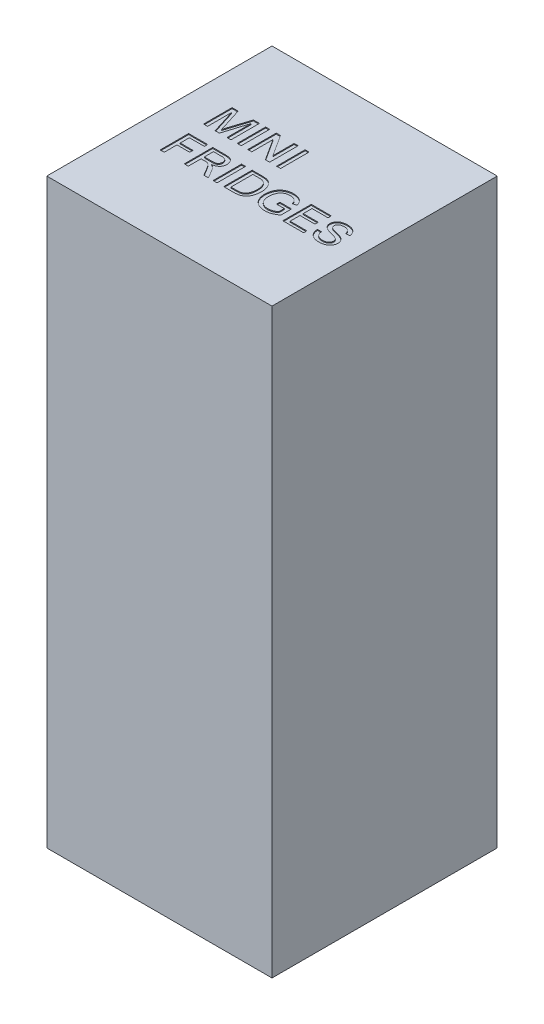
from build123d import *

# Parameters (mm, degrees)
SKETCH1_W           = 609.6
SKETCH1_H           = 609.6
BOSS_EXTRUDE1_DEPTH = 1574.8
SKETCH2_W           = 10.865963666
SKETCH2_H           = 77.049560547
SKETCH2_W_2         = 10.865963667
CUT_EXTRUDE1_DEPTH  = 2.54


with BuildPart() as part:
    # Sketch1 → Boss-Extrude1 (new body)
    with BuildSketch(Plane(origin=(0, 0, 0), x_dir=(1, 0, 0), z_dir=(0, 1, 0))):
        Rectangle(SKETCH1_W, SKETCH1_H)
    extrude(amount=BOSS_EXTRUDE1_DEPTH)

    # Sketch2 → Cut-Extrude1 (cut)
    # profile 1 of 11: a face of its own
    with BuildSketch(Plane(origin=(0, 1574.8, 0), x_dir=(1, 0, 0), z_dir=(0, 1, 0))):
        with BuildLine():
            Line((-214.489253179, 29.371225042), (-214.489253179, 106.420785589))
            Line((-214.489253179, 106.420785589), (-198.144003856, 106.420785589))
            Line((-198.144003856, 106.420785589), (-180.918981907, 52.353355582))
            add(Edge.make_bspline(
                [(-180.918981907, 52.353355582), (-180.729419808, 51.740865825), (-180.362817744, 50.55634629), (-179.819190376, 48.845791087), (-179.324580609, 47.256213448), (-178.879106629, 45.782553663), (-178.458707079, 44.432128387), (-178.09470731, 43.193856382), (-177.746711688, 42.081497605), (-177.542770703, 41.374557231), (-177.446195223, 41.039788298)],
                knots=[0, 0, 0, 0, 1.300204174, 2.514519184, 3.639827924, 4.676153899, 5.636536826, 6.507959918, 7.293450077, 8, 8, 8, 8], degree=3))
            add(Edge.make_bspline(
                [(-177.446195223, 41.039788298), (-177.338632565, 41.405217862), (-177.109732348, 42.182875343), (-176.738648507, 43.405608427), (-176.343804734, 44.758700172), (-175.871297766, 46.21889314), (-175.378765174, 47.809093173), (-174.861788117, 49.527979662), (-174.265465149, 51.358391588), (-173.869178735, 52.625613897), (-173.66471639, 53.279432031)],
                knots=[0, 0, 0, 0, 0.713638162, 1.518667645, 2.393860736, 3.354087503, 4.393659122, 5.512594909, 6.716633584, 8, 8, 8, 8], degree=3))
            Line((-173.66471639, 53.279432031), (-156.609475124, 106.420785589))
            Line((-156.609475124, 106.420785589), (-140.403137268, 106.420785589))
            Line((-140.403137268, 106.420785589), (-140.403137268, 29.371225042))
            Line((-140.403137268, 29.371225042), (-151.269100935, 29.371225042))
            Line((-151.269100935, 29.371225042), (-151.269100935, 94.567007043))
            Line((-151.269100935, 94.567007043), (-171.8279981, 29.371225042))
            Line((-171.8279981, 29.371225042), (-183.187869206, 29.371225042))
            Line((-183.187869206, 29.371225042), (-203.623289512, 94.567007043))
            Line((-203.623289512, 94.567007043), (-203.623289512, 29.371225042))
            Line((-203.623289512, 29.371225042), (-214.489253179, 29.371225042))
        make_face()
    # profile 2 of 11: a face of its own
    with BuildSketch(Plane(origin=(0, 1574.8, 0), x_dir=(1, 0, 0), z_dir=(0, 1, 0))):
        with Locations((-118.177302495, 67.896005316)):
            Rectangle(SKETCH2_W, SKETCH2_H)
    # profile 3 of 11: a face of its own
    with BuildSketch(Plane(origin=(0, 1574.8, 0), x_dir=(1, 0, 0), z_dir=(0, 1, 0))):
        Polygon((-94.963652843, 29.371225042), (-94.963652843, 106.420785589), (-83.480304877, 106.420785589), (-46.560723782, 48.926872721), (-46.560723782, 106.420785589), (-35.694760115, 106.420785589), (-35.694760115, 29.371225042), (-47.178108081, 29.371225042), (-84.097689176, 86.86513791), (-84.097689176, 29.371225042), align=None)
    # profile 4 of 11: a face of its own
    with BuildSketch(Plane(origin=(0, 1574.8, 0), x_dir=(1, 0, 0), z_dir=(0, 1, 0))):
        with Locations((-11.493295584, 67.896005316)):
            Rectangle(SKETCH2_W, SKETCH2_H)
    # profile 5 of 11: a face of its own
    with BuildSketch(Plane(origin=(0, 1574.8, 0), x_dir=(1, 0, 0), z_dir=(0, 1, 0))):
        Polygon((-212.513623421, -90.166560415), (-212.513623421, -13.116999868), (-161.147249723, -13.116999868), (-161.147249723, -22.007333777), (-201.647659754, -22.007333777), (-201.647659754, -46.702705747), (-167.074138996, -46.702705747), (-167.074138996, -55.593039656), (-201.647659754, -55.593039656), (-201.647659754, -90.166560415), align=None)
    # profile 6 of 11: a face of its own
    with BuildSketch(Plane(origin=(0, 1574.8, 0), x_dir=(1, 0, 0), z_dir=(0, 1, 0))):
        with BuildLine():
            Line((-147.31784142, -90.166560415), (-147.31784142, -13.116999868))
            Line((-147.31784142, -13.116999868), (-113.886481615, -13.116999868))
            add(Edge.make_bspline(
                [(-113.886481615, -13.116999868), (-113.099275458, -13.123167954), (-111.57573008, -13.135105562), (-109.366274704, -13.219610273), (-107.303969607, -13.401780261), (-105.385022899, -13.598771715), (-103.609775523, -13.901127285), (-101.980058953, -14.247922294), (-100.49335699, -14.660613598), (-99.143023175, -15.148033842), (-97.890207837, -15.699476827), (-96.72894265, -16.379868441), (-95.610955317, -17.125432574), (-94.577738249, -18.001359165), (-93.602040243, -18.960417707), (-92.684765609, -20.015639772), (-91.839493866, -21.176182537), (-90.796952399, -22.837159911), (-89.678517962, -25.049231997), (-88.7466864, -27.880204961), (-88.145858079, -30.841506013), (-88.081567732, -32.865212233), (-88.048948691, -33.891981538)],
                knots=[0, 0, 0, 0, 1.242255013, 2.404239178, 3.487702428, 4.508875116, 5.447164253, 6.327763259, 7.137389581, 7.87956647, 8.591787438, 9.293660819, 10.000726923, 10.709654955, 11.427269343, 12.158170644, 12.913245971, 13.690346794, 15.251572448, 16.809945773, 18.381459854, 20, 20, 20, 20], degree=3))
            add(Edge.make_bspline(
                [(-88.048948691, -33.891981538), (-88.064025952, -34.551075861), (-88.093804575, -35.852832349), (-88.321911824, -37.766762826), (-88.734653473, -39.595446434), (-89.263913285, -41.354898457), (-89.988308507, -43.02019027), (-90.82748893, -44.625335967), (-91.867114164, -46.126237913), (-93.031089577, -47.56286272), (-94.365857239, -48.904441721), (-95.883159073, -50.102574044), (-97.567954413, -51.180296467), (-99.42817797, -52.107874209), (-101.4424167, -52.955724302), (-103.635943767, -53.638454049), (-105.999906277, -54.19595524), (-107.638714975, -54.465918831), (-108.484368997, -54.605224778)],
                knots=[0, 0, 0, 0, 0.982609109, 1.940720374, 2.867584677, 3.775009516, 4.675469332, 5.571146231, 6.471115823, 7.392408543, 8.32534739, 9.286126426, 10.269214477, 11.301811357, 12.381622301, 13.524260118, 14.722474812, 16, 16, 16, 16], degree=3))
            add(Edge.make_bspline(
                [(-108.484368997, -54.605224778), (-107.864049734, -54.918596386), (-106.686041122, -55.513700353), (-105.055073601, -56.446818205), (-103.672558892, -57.400234709), (-102.871598064, -58.082146218), (-102.495741294, -58.402138218)],
                knots=[0, 0, 0, 0, 1.172304973, 2.226249348, 3.167654437, 4, 4, 4, 4], degree=3))
            add(Edge.make_bspline(
                [(-102.495741294, -58.402138218), (-101.767873424, -59.115661438), (-100.272781109, -60.581288824), (-98.212478958, -63.077681596), (-96.214945264, -65.856549817), (-95.001292933, -67.864847298), (-94.377137759, -68.897671305)],
                knots=[0, 0, 0, 0, 0.918110279, 1.885863737, 2.912745394, 4, 4, 4, 4], degree=3))
            Line((-94.377137759, -68.897671305), (-81.736194232, -90.166560415))
            Line((-81.736194232, -90.166560415), (-94.191922469, -90.166560415))
            Line((-94.191922469, -90.166560415), (-103.792248322, -73.898484129))
            add(Edge.make_bspline(
                [(-103.792248322, -73.898484129), (-104.137427818, -73.327699119), (-104.806329003, -72.22161149), (-105.7725328, -70.606223756), (-106.719863856, -69.119001961), (-107.598497207, -67.717440498), (-108.444089266, -66.426984023), (-109.248469635, -65.243149743), (-109.989501409, -64.150407297), (-110.907365065, -62.878170715), (-111.975605913, -61.470429132), (-113.222169689, -60.020721131), (-114.409267995, -58.864888254), (-115.871201468, -57.731471166), (-117.682027246, -56.671349997), (-119.22126334, -56.184253444), (-119.967716963, -55.948035628)],
                knots=[0, 0, 0, 0, 1.130940588, 2.191577161, 3.191089816, 4.120344442, 4.99615009, 5.80661983, 6.546979556, 7.234477901, 8.466216387, 9.541989141, 10.473533583, 11.269175393, 12.675684693, 14, 14, 14, 14], degree=3))
            add(Edge.make_bspline(
                [(-119.967716963, -55.948035628), (-120.280901237, -55.89155786), (-120.995910325, -55.762617421), (-122.209993971, -55.678406215), (-123.681005254, -55.589027286), (-124.747072199, -55.591631488), (-125.323525759, -55.593039656)],
                knots=[0, 0, 0, 0, 0.709978628, 1.620902492, 2.713552433, 4, 4, 4, 4], degree=3))
            Line((-125.323525759, -55.593039656), (-136.451877753, -55.593039656))
            Line((-136.451877753, -55.593039656), (-136.451877753, -90.166560415))
            Line((-136.451877753, -90.166560415), (-147.31784142, -90.166560415))
        make_face()
        with BuildLine():
            Line((-136.451877753, -46.702705747), (-115.81580755, -46.702705747))
            add(Edge.make_bspline(
                [(-115.81580755, -46.702705747), (-114.781036824, -46.686515778), (-112.846630005, -46.656250149), (-110.141668091, -46.397813486), (-107.836438686, -45.987146655), (-105.885370695, -45.388140987), (-104.246165613, -44.556522203), (-102.820517809, -43.543039314), (-101.635786538, -42.273546491), (-100.650212503, -40.841194123), (-99.884105586, -39.264961839), (-99.331472597, -37.609360923), (-98.969764693, -35.888305629), (-98.933358411, -34.716979222), (-98.914912358, -34.12350065)],
                knots=[0, 0, 0, 0, 1.546323217, 2.890706218, 4.056530419, 5.041445823, 5.928701482, 6.793137403, 7.641659452, 8.509781392, 9.383301667, 10.251423607, 11.114044887, 12, 12, 12, 12], degree=3))
            add(Edge.make_bspline(
                [(-98.914912358, -34.12350065), (-98.929253394, -33.691010247), (-98.957343269, -32.843888599), (-99.104599687, -31.600549213), (-99.390901124, -30.419089409), (-99.768961469, -29.293263858), (-100.274126809, -28.231318426), (-100.874242623, -27.225024212), (-101.590366052, -26.279958504), (-102.410644234, -25.393242486), (-103.352472656, -24.586417566), (-104.428262132, -23.890302656), (-105.629527974, -23.298755158), (-106.957666459, -22.829263518), (-108.408493707, -22.453746631), (-109.990268959, -22.203927357), (-111.695758418, -22.023158963), (-112.877563709, -22.012707391), (-113.485181821, -22.007333777)],
                knots=[0, 0, 0, 0, 0.965208469, 1.890559848, 2.786986821, 3.67262109, 4.535197034, 5.405224191, 6.282113641, 7.175449223, 8.095446547, 9.040936516, 10.026471658, 11.075712529, 12.17809725, 13.364958037, 14.645208957, 16, 16, 16, 16], degree=3))
            Line((-113.485181821, -22.007333777), (-136.451877753, -22.007333777))
            Line((-136.451877753, -22.007333777), (-136.451877753, -46.702705747))
        make_face(mode=Mode.SUBTRACT)
    # profile 7 of 11: a face of its own
    with BuildSketch(Plane(origin=(0, 1574.8, 0), x_dir=(1, 0, 0), z_dir=(0, 1, 0))):
        with Locations((-63.847484161, -51.641780142)):
            Rectangle(SKETCH2_W_2, SKETCH2_H)
    # profile 8 of 11: a face of its own
    with BuildSketch(Plane(origin=(0, 1574.8, 0), x_dir=(1, 0, 0), z_dir=(0, 1, 0))):
        with BuildLine():
            Line((-40.633834509, -90.166560415), (-40.633834509, -13.116999868))
            Line((-40.633834509, -13.116999868), (-14.286959538, -13.116999868))
            add(Edge.make_bspline(
                [(-14.286959538, -13.116999868), (-13.566671112, -13.120253851), (-12.167095555, -13.126576591), (-10.13406982, -13.166874131), (-8.230414279, -13.264071381), (-6.464900749, -13.382470488), (-4.828624923, -13.540108729), (-3.323677255, -13.71638753), (-1.948883471, -13.946320181), (-1.084535567, -14.137437095), (-0.67363574, -14.228291606)],
                knots=[0, 0, 0, 0, 1.263127796, 2.454354013, 3.565393221, 4.605443485, 5.557051711, 6.447822442, 7.26211484, 8, 8, 8, 8], degree=3))
            add(Edge.make_bspline(
                [(-0.67363574, -14.228291606), (0.389022014, -14.507092288), (2.476716999, -15.054823469), (5.423718067, -16.286873958), (8.129193294, -17.83225649), (9.733710423, -19.105207579), (10.531889292, -19.738446477)],
                knots=[0, 0, 0, 0, 1.04477941, 2.052571232, 3.03123721, 4, 4, 4, 4], degree=3))
            add(Edge.make_bspline(
                [(10.531889292, -19.738446477), (11.02747399, -20.173650268), (12.020886714, -21.046027854), (13.385333175, -22.483333666), (14.651107608, -24.008081545), (15.856016763, -25.594021688), (16.922995742, -27.298973311), (17.923138816, -29.073863343), (18.795505767, -30.95433396), (19.598506402, -32.909652859), (20.313925183, -34.947441268), (20.901759927, -37.066383215), (21.441792966, -39.244351864), (21.843452131, -41.505154885), (22.194079804, -43.829615901), (22.416667724, -46.231039218), (22.561090252, -48.702256162), (22.57782669, -50.375927366), (22.586317735, -51.225045739)],
                knots=[0, 0, 0, 0, 0.908997367, 1.822109427, 2.728529095, 3.640759027, 4.565643067, 5.499218265, 6.448003669, 7.421473682, 8.413047621, 9.423472075, 10.452328391, 11.505545429, 12.587978234, 13.692612971, 14.829372988, 16, 16, 16, 16], degree=3))
            add(Edge.make_bspline(
                [(22.586317735, -51.225045739), (22.565620509, -52.646028699), (22.525344196, -55.411228087), (22.127026791, -59.433159116), (21.510664428, -63.213642594), (20.613636247, -66.729977905), (19.508852381, -69.962662198), (18.303629096, -72.938097543), (16.916331442, -75.605014505), (15.394497028, -77.985957013), (13.763891788, -80.095989629), (12.055639228, -81.966780322), (10.264675539, -83.599156927), (8.400098389, -85.035959529), (6.365070027, -86.225671591), (4.180939637, -87.293932806), (1.776847037, -88.152280288), (-0.801934177, -88.903095776), (-3.585692985, -89.465588659), (-6.55935519, -89.87892653), (-9.734607483, -90.128877118), (-11.914713304, -90.15375594), (-13.036756332, -90.166560415)],
                knots=[0, 0, 0, 0, 1.410753827, 2.745293735, 4.009435601, 5.211453015, 6.344066657, 7.400119332, 8.396481539, 9.324811333, 10.202671465, 11.041621015, 11.837259285, 12.606727868, 13.374311266, 14.17412185, 15.017911533, 15.905707008, 16.839601966, 17.835295848, 18.885883805, 20, 20, 20, 20], degree=3))
            Line((-13.036756332, -90.166560415), (-40.633834509, -90.166560415))
        make_face()
        with BuildLine():
            Line((-29.767870842, -81.276226505), (-13.885659744, -81.276226505))
            add(Edge.make_bspline(
                [(-13.885659744, -81.276226505), (-12.72756842, -81.258890348), (-10.536717658, -81.2260942), (-7.445773192, -80.974220721), (-4.748090994, -80.539772773), (-2.413756691, -79.921670618), (-0.388357317, -79.122369615), (1.395016739, -78.177404904), (2.98135023, -77.105082354), (3.874932089, -76.247179468), (4.311742477, -75.827810064)],
                knots=[0, 0, 0, 0, 1.423649224, 2.693227144, 3.808972214, 4.778671344, 5.656058397, 6.479437267, 7.256702014, 8, 8, 8, 8], degree=3))
            add(Edge.make_bspline(
                [(4.311742477, -75.827810064), (4.880164041, -75.177862932), (6.04789744, -73.842647976), (7.502028375, -71.510098477), (8.770101353, -68.885533662), (9.830138306, -65.94101343), (10.699341176, -62.686497258), (11.279066332, -59.092834007), (11.658095503, -55.184458932), (11.699084416, -52.465938716), (11.720354068, -51.055265057)],
                knots=[0, 0, 0, 0, 0.782184731, 1.606876467, 2.483531085, 3.422528604, 4.441347086, 5.534669947, 6.720709839, 8, 8, 8, 8], degree=3))
            add(Edge.make_bspline(
                [(11.720354068, -51.055265057), (11.707175523, -50.072432606), (11.681556965, -48.161846125), (11.521847192, -45.378442033), (11.206556611, -42.773454246), (10.803329458, -40.342377163), (10.252786022, -38.092938387), (9.623230084, -36.0035858), (8.831227124, -34.10163239), (7.92745468, -32.372395028), (6.936005811, -30.804389734), (5.902880481, -29.363936826), (4.822791691, -28.055759007), (3.672853194, -26.898469324), (2.487633493, -25.857844147), (1.245036903, -24.955188573), (-0.051459352, -24.190779955), (-0.962498978, -23.793969558), (-1.414496899, -23.597098348)],
                knots=[0, 0, 0, 0, 1.460126857, 2.838427476, 4.139102445, 5.35666337, 6.496721546, 7.577303074, 8.594995104, 9.55219858, 10.472533725, 11.348579167, 12.184287935, 12.989560785, 13.769667798, 14.524891986, 15.268148459, 16, 16, 16, 16], degree=3))
            add(Edge.make_bspline(
                [(-1.414496899, -23.597098348), (-1.76767012, -23.467852223), (-2.516021017, -23.193988159), (-3.737402248, -22.884015227), (-5.100476057, -22.598754269), (-6.618677783, -22.39853827), (-8.284329161, -22.20395016), (-10.107783829, -22.085703008), (-12.079478553, -22.032116507), (-13.44317345, -22.015778607), (-14.148048071, -22.007333777)],
                knots=[0, 0, 0, 0, 0.699400087, 1.48198292, 2.341906832, 3.289648813, 4.329964754, 5.462247508, 6.688271602, 8, 8, 8, 8], degree=3))
            Line((-14.148048071, -22.007333777), (-29.767870842, -22.007333777))
            Line((-29.767870842, -22.007333777), (-29.767870842, -81.276226505))
        make_face(mode=Mode.SUBTRACT)
    # profile 9 of 11: a face of its own
    with BuildSketch(Plane(origin=(0, 1574.8, 0), x_dir=(1, 0, 0), z_dir=(0, 1, 0))):
        with BuildLine():
            Line((71.977061675, -59.544299172), (71.977061675, -50.653965262))
            Line((71.977061675, -50.653965262), (103.587137797, -50.653965262))
            Line((103.587137797, -50.653965262), (103.587137797, -79.16168528))
            add(Edge.make_bspline(
                [(103.587137797, -79.16168528), (102.339960156, -80.111570808), (99.885359803, -81.981063393), (96.03581964, -84.419146704), (92.123140445, -86.486931144), (88.158135505, -88.194026722), (84.127176557, -89.511563993), (80.047666531, -90.45462616), (75.915162883, -91.051951183), (73.136642834, -91.120203787), (71.745542563, -91.154375293)],
                knots=[0, 0, 0, 0, 1.08433114, 2.134098231, 3.14842993, 4.143565882, 5.117308249, 6.078377492, 7.037916032, 8, 8, 8, 8], degree=3))
            add(Edge.make_bspline(
                [(71.745542563, -91.154375293), (70.813793803, -91.140072137), (68.962842529, -91.111658421), (66.222415133, -90.868577713), (63.545976778, -90.507394338), (60.938604083, -89.976293676), (58.391091982, -89.300144244), (55.908347297, -88.464544524), (53.489329372, -87.489463277), (51.147522465, -86.371575766), (48.918125378, -85.090763231), (46.807272583, -83.686453196), (44.841593089, -82.137489994), (43.018061306, -80.456543285), (41.343270632, -78.63361248), (39.79240688, -76.692925825), (38.407069309, -74.598921221), (37.156667395, -72.390116232), (36.052558029, -70.083225562), (35.088519727, -67.697935699), (34.291650793, -65.239968905), (33.62705145, -62.720198983), (33.098526399, -60.139575631), (32.729368032, -57.490010928), (32.512063495, -54.773531311), (32.480436045, -52.938676611), (32.464466523, -52.012210721)],
                knots=[0, 0, 0, 0, 1.072770755, 2.131096365, 3.165876834, 4.181397123, 5.193125461, 6.199217581, 7.195986042, 8.195005739, 9.184865672, 10.154356418, 11.112044544, 12.063776475, 13.007136321, 13.960176652, 14.921449994, 15.895149614, 16.88092309, 17.86448639, 18.855604391, 19.854360534, 20.864074582, 21.88711945, 22.933151623, 24, 24, 24, 24], degree=3))
            add(Edge.make_bspline(
                [(32.464466523, -52.012210721), (32.480479967, -51.090889821), (32.512282048, -49.26118202), (32.731442825, -46.534643606), (33.101953794, -43.855844073), (33.61345902, -41.22325156), (34.258977439, -38.639149628), (35.063153081, -36.103038055), (36.025281278, -33.617240071), (37.11495606, -31.187008751), (38.328587695, -28.847116201), (39.722326729, -26.672341562), (41.187666453, -24.611870842), (42.84550157, -22.755280377), (44.580449271, -21.006711491), (46.477399299, -19.450450614), (48.488537968, -18.039650607), (50.622563471, -16.789474425), (52.866922706, -15.698437588), (55.194833349, -14.73755527), (57.611578738, -13.940202037), (60.103306865, -13.267490073), (62.683824661, -12.767654529), (65.34648068, -12.391656529), (68.094283491, -12.176897608), (69.954771386, -12.145221133), (70.896639151, -12.129184989)],
                knots=[0, 0, 0, 0, 1.059979929, 2.105079288, 3.144800512, 4.169876923, 5.189194625, 6.207600986, 7.228841866, 8.254191695, 9.270945245, 10.257936415, 11.22408152, 12.176290364, 13.118065146, 14.055588944, 14.994904974, 15.942096138, 16.897776019, 17.864011786, 18.837383209, 19.823806203, 20.831455606, 21.859450402, 22.916351634, 24, 24, 24, 24], degree=3))
            add(Edge.make_bspline(
                [(70.896639151, -12.129184989), (72.256315022, -12.161896329), (74.912942338, -12.225809973), (78.802418522, -12.722897788), (82.48093864, -13.573484321), (85.396135317, -14.550717007), (87.585680787, -15.503044145), (89.133370102, -16.272716445), (90.588168714, -17.113187987), (91.96682258, -17.997145958), (93.238546679, -18.982595779), (94.420051523, -20.023199576), (95.514446323, -21.13143403), (96.861806965, -22.713097534), (98.403129982, -24.910184466), (99.949648147, -27.893701518), (101.304208786, -31.219515194), (101.974629488, -33.601217966), (102.321499983, -34.833492594)],
                knots=[0, 0, 0, 0, 1.539867261, 3.008697525, 4.432261777, 5.810773619, 6.484177873, 7.135742803, 7.767512201, 8.386601754, 8.989234153, 9.587908519, 10.168964172, 10.7517707, 11.940093668, 13.199243526, 14.550910222, 16, 16, 16, 16], degree=3))
            Line((102.321499983, -34.833492594), (92.381612765, -37.333899006))
            add(Edge.make_bspline(
                [(92.381612765, -37.333899006), (92.094722655, -36.419507972), (91.545264145, -34.668245327), (90.577453495, -32.220593428), (89.450035573, -30.107065657), (88.244548047, -28.246688578), (86.80839318, -26.646318525), (85.140960861, -25.228279681), (83.192323993, -23.996759792), (81.005392641, -22.942336411), (78.627814145, -22.081310499), (76.097277709, -21.467727429), (73.439548322, -21.086128149), (71.623379566, -21.04203446), (70.695989254, -21.019518898)],
                knots=[0, 0, 0, 0, 1.164883671, 2.23101188, 3.193404931, 4.072828119, 4.918883984, 5.797350418, 6.725503451, 7.712871826, 8.743577122, 9.793233972, 10.87315899, 12, 12, 12, 12], degree=3))
            add(Edge.make_bspline(
                [(70.695989254, -21.019518898), (69.59901176, -21.04717191), (67.475128778, -21.100711534), (64.397324055, -21.484519909), (61.549128524, -22.139267568), (58.94008862, -23.072227782), (56.581162087, -24.219032658), (54.438598035, -25.515815287), (52.548718359, -27.00040276), (50.904339456, -28.65385851), (49.474280067, -30.422655297), (48.1990577, -32.266365892), (47.090086323, -34.19986528), (46.497766612, -35.558130549), (46.201267181, -36.238041875)],
                knots=[0, 0, 0, 0, 1.282088634, 2.482280855, 3.618640035, 4.691464057, 5.71354971, 6.679981643, 7.61357903, 8.515091979, 9.399860987, 10.268958177, 11.133486685, 12, 12, 12, 12], degree=3))
            add(Edge.make_bspline(
                [(46.201267181, -36.238041875), (45.758507848, -37.433885352), (44.867310318, -39.840910283), (43.99669818, -43.634451766), (43.434706335, -47.5706663), (43.365537513, -50.250655678), (43.33043019, -51.610910926)],
                knots=[0, 0, 0, 0, 0.971932623, 1.956331326, 2.96271565, 4, 4, 4, 4], degree=3))
            add(Edge.make_bspline(
                [(43.33043019, -51.610910926), (43.33575062, -52.444782169), (43.346173515, -54.078362674), (43.532986774, -56.476919695), (43.777251089, -58.77782575), (44.173679138, -60.969797214), (44.644995819, -63.059367123), (45.229594285, -65.047678377), (45.944178192, -66.924806748), (46.742324503, -68.709133907), (47.655541195, -70.38138532), (48.672507107, -71.939780068), (49.789447703, -73.383486897), (51.002554108, -74.714098408), (52.293831064, -75.958343284), (53.70371895, -77.068739983), (55.21636357, -78.061415803), (57.338542604, -79.243572007), (60.136701113, -80.436971333), (63.605212513, -81.501721802), (67.189961668, -82.134104231), (69.613126704, -82.220486791), (70.834900722, -82.264041384)],
                knots=[0, 0, 0, 0, 1.070760406, 2.097653971, 3.088708526, 4.041547766, 4.95691435, 5.839291284, 6.700934147, 7.534993757, 8.348268852, 9.145600082, 9.922850605, 10.690119832, 11.456705726, 12.223547942, 12.991528328, 13.778467112, 15.341275849, 16.888285822, 18.431055468, 20, 20, 20, 20], degree=3))
            add(Edge.make_bspline(
                [(70.834900722, -82.264041384), (71.906663473, -82.228769259), (74.045249237, -82.158387576), (77.229157858, -81.669993132), (80.363011721, -80.84068268), (83.392953671, -79.721021013), (86.227266091, -78.438541761), (88.736118332, -77.064366909), (90.914717991, -75.693165538), (92.140177516, -74.643221619), (92.72117413, -74.145437849)],
                knots=[0, 0, 0, 0, 1.08078364, 2.156585965, 3.240205791, 4.344938036, 5.41078367, 6.374425311, 7.229306744, 8, 8, 8, 8], degree=3))
            Line((92.72117413, -74.145437849), (92.72117413, -59.544299172))
            Line((92.72117413, -59.544299172), (71.977061675, -59.544299172))
        make_face()
    # profile 10 of 11: a face of its own
    with BuildSketch(Plane(origin=(0, 1574.8, 0), x_dir=(1, 0, 0), z_dir=(0, 1, 0))):
        Polygon((119.392175858, -90.166560415), (119.392175858, -13.116999868), (173.721994192, -13.116999868), (173.721994192, -22.007333777), (130.258139525, -22.007333777), (130.258139525, -45.714890868), (170.758549556, -45.714890868), (170.758549556, -54.605224778), (130.258139525, -54.605224778), (130.258139525, -81.276226505), (175.69762395, -81.276226505), (175.69762395, -90.166560415), align=None)
    # profile 11 of 11: a face of its own
    with BuildSketch(Plane(origin=(0, 1574.8, 0), x_dir=(1, 0, 0), z_dir=(0, 1, 0))):
        with BuildLine():
            Line((186.563587617, -63.495558687), (197.429551284, -63.495558687))
            add(Edge.make_bspline(
                [(197.429551284, -63.495558687), (197.54907058, -64.471172806), (197.778673584, -66.345380064), (198.420666518, -69.001786715), (199.246952847, -71.390168915), (200.276482833, -73.542224712), (201.630790303, -75.432151088), (203.262497845, -77.136835817), (205.244117848, -78.612989569), (207.480915109, -79.926669694), (209.972083014, -80.958116366), (212.63162693, -81.722744762), (215.446863153, -82.17579318), (217.374563669, -82.234211855), (218.358879028, -82.264041384)],
                knots=[0, 0, 0, 0, 1.125557648, 2.162256852, 3.1243583, 4.018160113, 4.88511607, 5.777380551, 6.711250965, 7.707237736, 8.743031335, 9.791730543, 10.872421559, 12, 12, 12, 12], degree=3))
            add(Edge.make_bspline(
                [(218.358879028, -82.264041384), (219.22991335, -82.247919467), (220.928261609, -82.216484849), (223.3851122, -81.838877215), (225.697015744, -81.30325093), (227.820945307, -80.493032315), (229.749065928, -79.509172873), (231.423422677, -78.319171806), (232.852899405, -76.977177494), (233.972283297, -75.44784255), (234.851648931, -73.845355275), (235.496754529, -72.198163629), (235.881030713, -70.51541028), (235.929997493, -69.38316707), (235.954331557, -68.820498268)],
                knots=[0, 0, 0, 0, 1.267006637, 2.470417599, 3.611360613, 4.716023143, 5.771382139, 6.754486395, 7.697536124, 8.612899418, 9.501261124, 10.352596716, 11.181322154, 12, 12, 12, 12], degree=3))
            add(Edge.make_bspline(
                [(235.954331557, -68.820498268), (235.92831799, -68.263528977), (235.877474511, -67.174933291), (235.546141638, -65.590073956), (234.916396692, -64.139467319), (234.099230256, -62.763906379), (232.962412218, -61.506253918), (231.52617092, -60.347439357), (229.758862361, -59.296846854), (228.439832406, -58.721481162), (227.743120377, -58.417572826)],
                knots=[0, 0, 0, 0, 0.942140154, 1.841411588, 2.718743672, 3.605002079, 4.535543111, 5.568170452, 6.715506882, 8, 8, 8, 8], degree=3))
            add(Edge.make_bspline(
                [(227.743120377, -58.417572826), (227.471671067, -58.306178987), (226.858417762, -58.054520068), (225.807330376, -57.72136699), (224.560082081, -57.290566066), (223.086708738, -56.846911229), (221.395097964, -56.377586459), (219.488066119, -55.846381974), (217.366678823, -55.281475081), (215.091102283, -54.680193226), (212.793463416, -54.068781787), (210.598337902, -53.456797772), (208.578718072, -52.835555605), (206.718060515, -52.237385169), (205.025957766, -51.636746874), (203.497607249, -51.050084906), (202.131103482, -50.489301859), (201.296495002, -50.076966686), (200.902337967, -49.882234888)],
                knots=[0, 0, 0, 0, 0.499201778, 1.127787504, 1.87543728, 2.745208432, 3.745951656, 4.863402235, 6.114490242, 7.482339553, 8.869366102, 10.161191451, 11.360587006, 12.46547846, 13.487450326, 14.41601931, 15.251940103, 16, 16, 16, 16], degree=3))
            add(Edge.make_bspline(
                [(200.902337967, -49.882234888), (199.995492567, -49.39233088), (198.245044937, -48.446688647), (195.889136297, -46.755877688), (193.904044103, -44.879609982), (192.298143068, -42.820606196), (191.039661267, -40.613689027), (190.190569098, -38.255106696), (189.609011056, -35.787671878), (189.554662942, -34.090923593), (189.527032253, -33.228293416)],
                knots=[0, 0, 0, 0, 1.158441928, 2.236094408, 3.251151369, 4.220012324, 5.163146324, 6.095083285, 7.031536583, 8, 8, 8, 8], degree=3))
            add(Edge.make_bspline(
                [(189.527032253, -33.228293416), (189.563703673, -32.273076206), (189.636642861, -30.373156108), (190.283653435, -27.585141805), (191.315647678, -24.902330461), (192.490370539, -22.772407183), (193.635984924, -21.161768731), (194.585707952, -20.001816362), (195.651008078, -18.929596339), (196.799077762, -17.930141194), (198.050439913, -17.018383944), (199.374048111, -16.156852511), (200.81780958, -15.416345571), (202.846509154, -14.473847378), (205.560420363, -13.532674795), (208.976895129, -12.712562271), (212.572622639, -12.229615057), (215.023554981, -12.163135194), (216.275207018, -12.129184989)],
                knots=[0, 0, 0, 0, 1.199927478, 2.386647047, 3.578628709, 4.806592355, 5.433127754, 6.062729195, 6.689531802, 7.331674828, 7.974827539, 8.635320743, 9.315455226, 10.01318112, 11.447700238, 12.918145351, 14.426146008, 16, 16, 16, 16], degree=3))
            add(Edge.make_bspline(
                [(216.275207018, -12.129184989), (217.645223311, -12.16057682), (220.312909012, -12.221702764), (224.189131738, -12.730259481), (227.804586389, -13.603585187), (230.639949975, -14.581185694), (232.736101116, -15.570873565), (234.225265253, -16.343116962), (235.607504047, -17.235971005), (236.895260436, -18.20217876), (238.100495934, -19.241298964), (239.192233281, -20.378048852), (240.217878759, -21.573644575), (241.42315512, -23.290145433), (242.722698557, -25.561924608), (243.846330751, -28.505104764), (244.618279174, -31.611389768), (244.768440906, -33.75884412), (244.844665466, -34.848927201)],
                knots=[0, 0, 0, 0, 1.607600973, 3.130308851, 4.577334065, 5.967726088, 6.640410691, 7.296826776, 7.935019992, 8.569057421, 9.185393759, 9.8003086, 10.417295362, 11.032210203, 12.259799365, 13.477607022, 14.719591916, 16, 16, 16, 16], degree=3))
            Line((244.844665466, -34.848927201), (233.978701799, -34.848927201))
            add(Edge.make_bspline(
                [(233.978701799, -34.848927201), (233.909661067, -34.29720428), (233.774568817, -33.217646039), (233.439422877, -31.654823074), (232.969615709, -30.203343429), (232.419327536, -28.849671074), (231.752263062, -27.607885691), (230.97465891, -26.466063424), (230.077045509, -25.437656887), (229.082519397, -24.495491638), (227.960817326, -23.675128707), (226.717702952, -22.963028497), (225.351077857, -22.36146688), (223.862146036, -21.868768295), (222.250612708, -21.486749085), (220.512812424, -21.205728461), (218.649416869, -21.061805217), (217.366125377, -21.033862616), (216.707376028, -21.019518898)],
                knots=[0, 0, 0, 0, 1.074487479, 2.102453544, 3.083708351, 4.020042547, 4.923259678, 5.803182661, 6.684453325, 7.556870173, 8.445961597, 9.363679789, 10.320905216, 11.327237703, 12.390948353, 13.519046902, 14.726457512, 16, 16, 16, 16], degree=3))
            add(Edge.make_bspline(
                [(216.707376028, -21.019518898), (216.022636805, -21.024680139), (214.697150074, -21.034671031), (212.781008688, -21.216792515), (211.004993304, -21.466669652), (209.372154417, -21.835259676), (207.887840993, -22.317745255), (206.530023694, -22.874905385), (205.336702478, -23.580972787), (204.280058966, -24.367440041), (203.368570109, -25.237622613), (202.583001735, -26.154584654), (201.888227184, -27.09138516), (201.348372033, -28.099230261), (200.908848797, -29.139951332), (200.625308016, -30.233110521), (200.424554518, -31.358487222), (200.40366082, -32.126354313), (200.39299592, -32.518301472)],
                knots=[0, 0, 0, 0, 1.464176581, 2.834285765, 4.113735764, 5.29917439, 6.409476712, 7.449999357, 8.431575861, 9.367089851, 10.262376129, 11.120706676, 11.948504824, 12.751342953, 13.560717798, 14.359016663, 15.162382702, 16, 16, 16, 16], degree=3))
            add(Edge.make_bspline(
                [(200.39299592, -32.518301472), (200.421076128, -33.181202024), (200.475577222, -34.467830873), (201.032113079, -36.295742625), (201.888069122, -37.962002623), (202.731322205, -38.868606179), (203.155790659, -39.324963371)],
                knots=[0, 0, 0, 0, 1.050964922, 2.039826012, 3.013306874, 4, 4, 4, 4], degree=3))
            add(Edge.make_bspline(
                [(203.155790659, -39.324963371), (203.423371047, -39.553028859), (204.015108553, -40.057381605), (205.1161274, -40.724833412), (206.481227482, -41.399208399), (208.119530172, -42.069589322), (210.028216714, -42.744114535), (212.204208356, -43.438621191), (214.655793196, -44.128396145), (217.308259259, -44.793108442), (219.987868474, -45.460492934), (222.534398095, -46.125333827), (224.872543336, -46.755420041), (226.998594561, -47.369965931), (228.914752298, -47.967233784), (230.614357198, -48.559737132), (232.111159706, -49.10468992), (233.028128075, -49.488108699), (233.453925145, -49.666150384)],
                knots=[0, 0, 0, 0, 0.523891492, 1.158553688, 1.913783773, 2.794766643, 3.797521443, 4.933638669, 6.202080764, 7.596537849, 9.013317056, 10.322179469, 11.523240428, 12.626146501, 13.623953177, 14.517289671, 15.311498917, 16, 16, 16, 16], degree=3))
            add(Edge.make_bspline(
                [(233.453925145, -49.666150384), (234.007908745, -49.921572399), (235.095285714, -50.42292301), (236.635700797, -51.278903759), (238.07307519, -52.167793686), (239.395795868, -53.113524708), (240.599585836, -54.118086149), (241.697904872, -55.169967943), (242.697386438, -56.263258344), (243.557701548, -57.432949009), (244.330176251, -58.631755774), (245.006143054, -59.876433503), (245.550418542, -61.174301908), (246.027782093, -62.509716389), (246.371143411, -63.89753064), (246.64040794, -65.323726812), (246.797465436, -66.795008439), (246.812619506, -67.791159307), (246.820295224, -68.295721614)],
                knots=[0, 0, 0, 0, 1.198900896, 2.353241543, 3.461831299, 4.520043694, 5.547003373, 6.541368882, 7.508191797, 8.454912692, 9.392021408, 10.310662301, 11.235020644, 12.156274873, 13.095836685, 14.042125239, 15.00831306, 16, 16, 16, 16], degree=3))
            add(Edge.make_bspline(
                [(246.820295224, -68.295721614), (246.780084518, -69.302690843), (246.700252901, -71.301859453), (246.012873888, -74.248726442), (244.933037815, -77.104224105), (243.666662539, -79.370218798), (242.469555139, -81.101109434), (241.463928455, -82.345194517), (240.348746279, -83.495540756), (239.151463265, -84.588186315), (237.862783638, -85.600837655), (236.47184303, -86.533839602), (234.993322161, -87.396904621), (232.882031541, -88.448599888), (230.077886848, -89.548773004), (226.505969445, -90.464959917), (222.741601144, -91.059313022), (220.156753499, -91.122249958), (218.83735186, -91.154375293)],
                knots=[0, 0, 0, 0, 1.197055466, 2.376552968, 3.581957237, 4.820753935, 5.454298064, 6.085440993, 6.72202542, 7.359198513, 8.013298489, 8.67051481, 9.351020706, 10.049282741, 11.476266879, 12.925760103, 14.430794493, 16, 16, 16, 16], degree=3))
            add(Edge.make_bspline(
                [(218.83735186, -91.154375293), (217.998448914, -91.147452284), (216.355157882, -91.133891097), (213.940525245, -90.969660841), (211.626538657, -90.732093706), (209.415468973, -90.378234814), (207.314249889, -89.913991162), (205.315338983, -89.356524258), (203.413998271, -88.714486187), (201.616871098, -87.959460544), (199.928648717, -87.082203223), (198.318975185, -86.135864535), (196.814161684, -85.063145282), (195.411040394, -83.880901611), (194.074059208, -82.623287489), (192.858632017, -81.238942988), (191.723437401, -79.768351329), (190.69441423, -78.198053097), (189.775138684, -76.548592988), (188.948448065, -74.847671911), (188.25194965, -73.082951012), (187.690638204, -71.263349152), (187.215178989, -69.401043129), (186.885459012, -67.480495245), (186.643037779, -65.507735327), (186.590227433, -64.170245984), (186.563587617, -63.495558687)],
                knots=[0, 0, 0, 0, 1.259822038, 2.467811403, 3.633536148, 4.752793854, 5.829021491, 6.863980041, 7.868367876, 8.841470325, 9.788447787, 10.724101269, 11.643985084, 12.560193707, 13.478453146, 14.398077254, 15.323914234, 16.266973849, 17.21495974, 18.158525798, 19.105629373, 20.061269543, 21.017128399, 21.990322895, 22.986232211, 24, 24, 24, 24], degree=3))
        make_face()
    extrude(amount=-CUT_EXTRUDE1_DEPTH, mode=Mode.SUBTRACT)


solid = part.part
